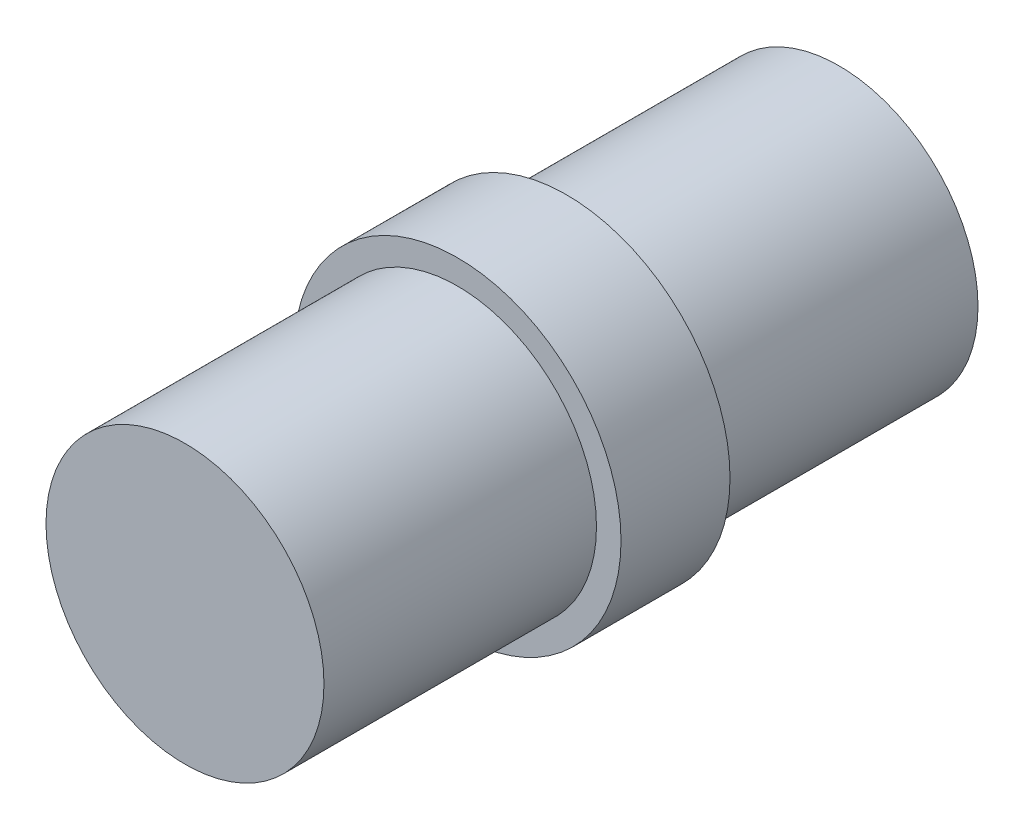
from build123d import *

# Parameters (mm, degrees)
SKETCH1_R           = 2.55
BOSS_EXTRUDE1_DEPTH = 5
SKETCH2_R           = 3
BOSS_EXTRUDE2_DEPTH = 2
BOSS_EXTRUDE3_START = -7
SKETCH1_2_R         = 2.55
BOSS_EXTRUDE3_DEPTH = 5


with BuildPart() as part:
    # Sketch1 → Boss-Extrude1 (new body)
    with BuildSketch(Plane.XY):
        Circle(SKETCH1_R)
    extrude(amount=BOSS_EXTRUDE1_DEPTH)

    # Sketch2 → Boss-Extrude2 (add)
    with BuildSketch(Plane.XY):
        Circle(SKETCH2_R)
    extrude(amount=-BOSS_EXTRUDE2_DEPTH)

    # Sketch1<2> → Boss-Extrude3 (add)
    with BuildSketch(Plane.XY.offset(BOSS_EXTRUDE3_START)):
        Circle(SKETCH1_2_R)
    extrude(amount=BOSS_EXTRUDE3_DEPTH)


solid = part.part
